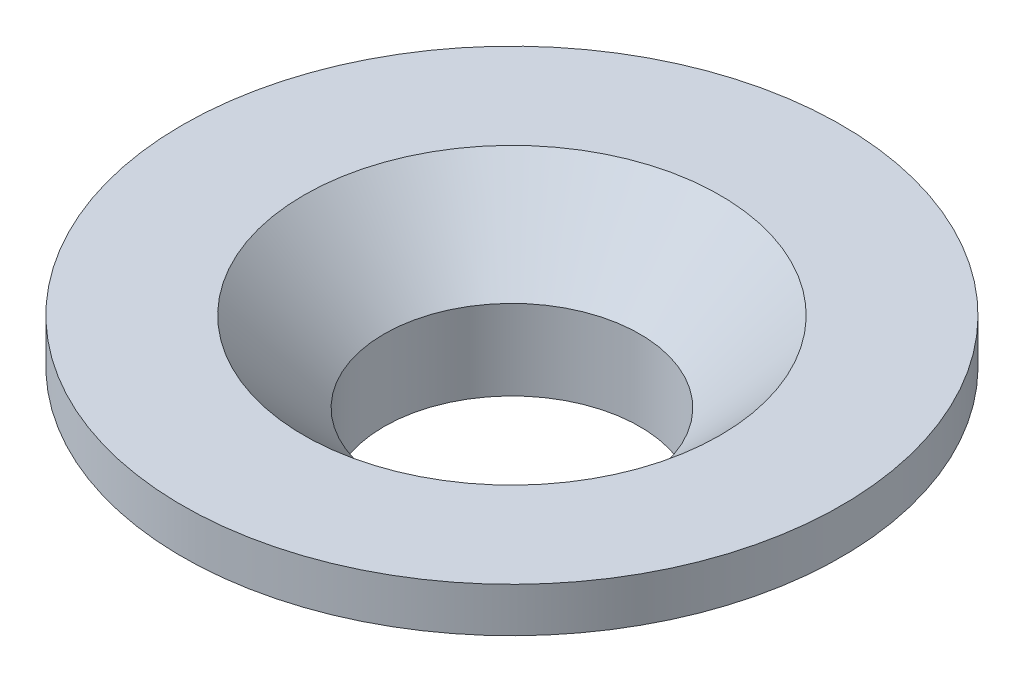
from build123d import *


with BuildPart() as part:
    # Sketch1 → Revolve1 (revolve)
    with BuildSketch(Plane.XY, mode=Mode.PRIVATE) as revolve1_sk:
        with BuildLine():
            Line((6.82, 5), (0, 5))
            Line((0, 5), (-4.5, 0.5))
            Line((-4.5, 0.5), (-4.5, -4))
            Line((-4.5, -4), (-2.5, -4))
            Line((-2.5, -4), (-2.5, 0))
            ThreePointArc((-2.5, 0), (-1.767766953, 1.767766953), (0, 2.5))
            Line((0, 2.5), (6.82, 2.5))
            Line((6.82, 2.5), (6.82, 5))
        make_face()
    revolve(revolve1_sk.sketch.rotate(Axis((-11.68, 6.133615875, 0), (0, -1, 0)), 180), axis=Axis((-11.68, 6.133615875, 0), (0, -1, 0)))


solid = part.part
